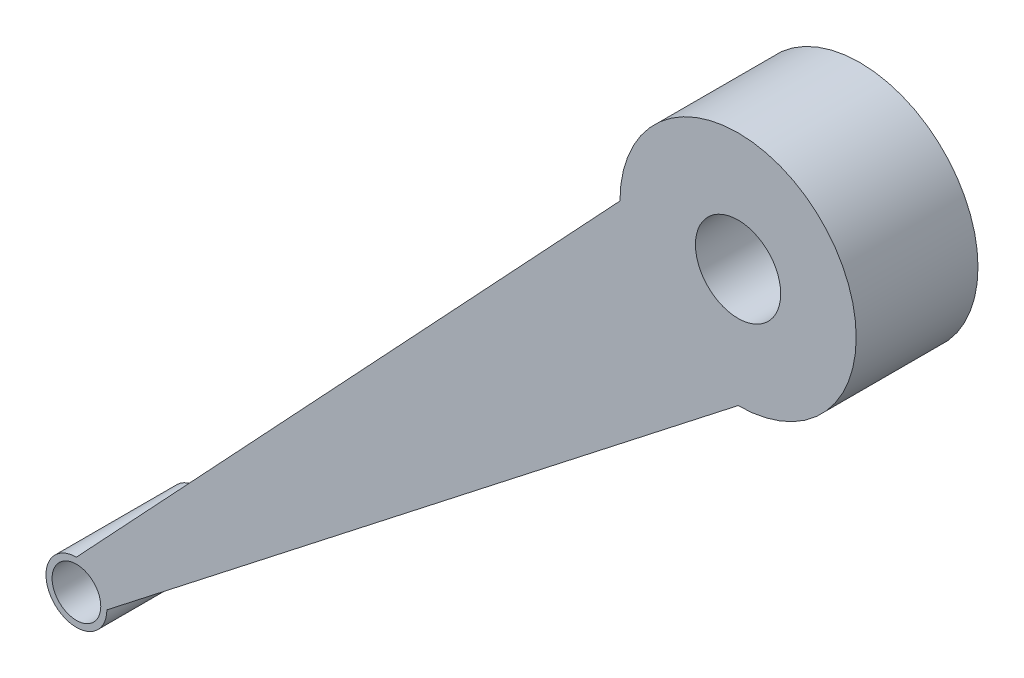
from build123d import *

# Parameters (mm, degrees)
SALIENTE_EXTRUIR2_DEPTH = 10
CROQUIS2_R              = 2
CORTAR_EXTRUIR1_DEPTH   = 90.57535888
SALIENTE_EXTRUIR3_START = -5
SALIENTE_EXTRUIR3_DEPTH = 5
CROQUIS4_R              = 3.5
CORTAR_EXTRUIR2_DEPTH   = 10


with BuildPart() as part:
    # Croquis1 → Saliente-Extruir2 (new body)
    with BuildSketch(Plane.XY):
        with BuildLine():
            Line((44.628418222, 52.139361077), (0, 4.5))
            ThreePointArc((0, 4.5), (-1.767766953, 0.232233047), (2.5, 2))
            Line((2.5, 2), (54.328418222, 42.439361077))
            ThreePointArc((54.328418222, 42.439361077), (61.187353999, 58.998296855), (44.628418222, 52.139361077))
        make_face()
        with BuildLine():
            Line((53.992751033, 43.445838918), (2.255737897, 3.077797078))
            ThreePointArc((2.255737897, 3.077797078), (1.78485494, 3.750512166), (1.121414308, 4.234374622))
            Line((1.121414308, 4.234374622), (45.636989072, 51.753279039))
            ThreePointArc((45.636989072, 51.753279039), (60.462381656, 58.309003902), (53.992751033, 43.445838918))
        make_face(mode=Mode.SUBTRACT)
    extrude(amount=SALIENTE_EXTRUIR2_DEPTH)

    # Croquis2 → Cortar-Extruir1 (cut, through all)
    with BuildSketch(Plane.XY.offset(10)):
        with Locations((0, 2)):
            Circle(CROQUIS2_R)
    extrude(amount=-CORTAR_EXTRUIR1_DEPTH, mode=Mode.SUBTRACT)

    # Croquis3 → Saliente-Extruir3 (add)
    with BuildSketch(Plane.XY.offset(10).offset(SALIENTE_EXTRUIR3_START)):
        with BuildLine():
            Line((53.992751033, 43.445838918), (2.255737897, 3.077797078))
            ThreePointArc((2.255737897, 3.077797078), (1.78485494, 3.750512166), (1.121414308, 4.234374622))
            Line((1.121414308, 4.234374622), (45.636989072, 51.753279039))
            ThreePointArc((45.636989072, 51.753279039), (60.462381656, 58.309003902), (53.992751033, 43.445838918))
        make_face()
    extrude(amount=SALIENTE_EXTRUIR3_DEPTH)

    # Croquis4 → Cortar-Extruir2 (cut)
    with BuildSketch(Plane(origin=(0, 0, 5), x_dir=(-1, 0, 0), z_dir=(0, 0, -1))):
        with Locations((-54.328418222, 52.139361077)):
            Circle(CROQUIS4_R)
    extrude(amount=-CORTAR_EXTRUIR2_DEPTH, mode=Mode.SUBTRACT)


solid = part.part
